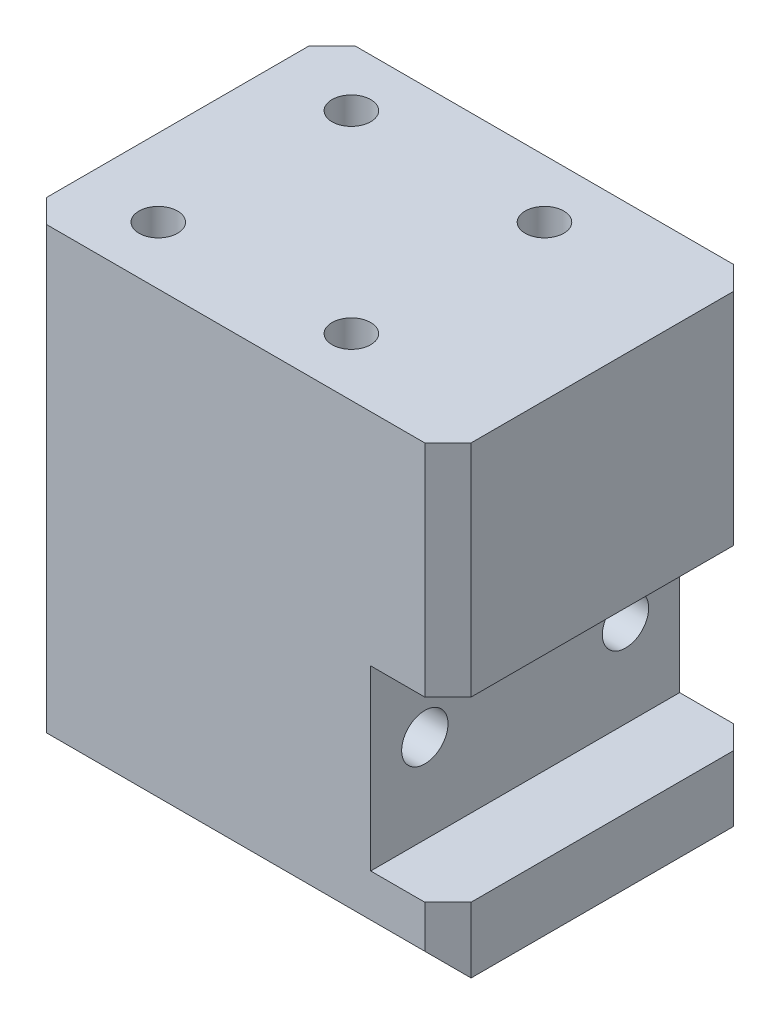
from build123d import *

# Parameters (mm, degrees)
SKETCH_1_W          = 22.5
SKETCH_1_H          = 20
EXTRUDE_1_DEPTH     = 20
SKETCH_2_W          = 20
SKETCH_2_H          = 4.25
EXTRUDE_2_DEPTH     = 5
SKETCH_3_R          = 1.5
CUT_EXTRUDE_1_DEPTH = 32.721443851
SKETCH_4_W          = 27.5
SKETCH_4_H          = 20
EXTRUDE_3_DEPTH     = 10
SKETCH_5_R          = 1.25
CUT_EXTRUDE_2_DEPTH = 15
CHAMFER_1_SIZE      = 1.5


with BuildPart() as part:
    # 草图1 → 凸台-拉伸1 (new body)
    with BuildSketch(Plane(origin=(0, 0, 0), x_dir=(1, 0, 0), z_dir=(0, 1, 0))):
        Rectangle(SKETCH_1_W, SKETCH_1_H)
    extrude(amount=EXTRUDE_1_DEPTH)

    # 草图2 → 凸台-拉伸2 (add)
    with BuildSketch(Plane(origin=(11.25, 0, 0), x_dir=(0, 0, -1), z_dir=(1, 0, 0))):
        with Locations((0, 17.875)):
            Rectangle(SKETCH_2_W, SKETCH_2_H)
        with Locations((0, 2.125)):
            Rectangle(SKETCH_2_W, SKETCH_2_H)
    extrude(amount=EXTRUDE_2_DEPTH)

    # 草图3 → 切除-拉伸1 (cut, through all)
    with BuildSketch(Plane(origin=(11.25, 0, 0), x_dir=(0, 0, -1), z_dir=(1, 0, 0))):
        with Locations((6.496047989, 10)):
            Circle(SKETCH_3_R)
        with Locations((-6.496047989, 10)):
            Circle(SKETCH_3_R)
    extrude(amount=-CUT_EXTRUDE_1_DEPTH, mode=Mode.SUBTRACT)

    # 草图4 → 凸台-拉伸3 (add)
    with BuildSketch(Plane(origin=(0, 20, 0), x_dir=(1, 0, 0), z_dir=(0, 1, 0))):
        with Locations((2.5, 0)):
            Rectangle(SKETCH_4_W, SKETCH_4_H)
    extrude(amount=EXTRUDE_3_DEPTH)

    # 草图5 → 切除-拉伸2 (cut)
    with BuildSketch(Plane(origin=(0, 30, 0), x_dir=(1, 0, 0), z_dir=(0, 1, 0))):
        with Locations(Location((6.25, 6.25, 0), (0, 0, 270))):
            Circle(SKETCH_5_R)
        with Locations(Location((6.25, -6.25, 0), (0, 0, 270))):
            Circle(SKETCH_5_R)
        with Locations(Location((-6.25, 6.25, 0), (0, 0, 270))):
            Circle(SKETCH_5_R)
        with Locations(Location((-6.25, -6.25, 0), (0, 0, 270))):
            Circle(SKETCH_5_R)
    extrude(amount=-CUT_EXTRUDE_2_DEPTH, mode=Mode.SUBTRACT)

    # 倒角1
    chamfer_1_edges = [part.edges().sort_by_distance(p)[0] for p in [
        (16.25, 22.875, 10),
        (16.25, 22.875, -10),
        (16.25, 2.125, -10),
        (16.25, 2.125, 10),
        (2.5, 0, -10),
        (2.5, 0, 10),
        (-11.25, 0, 0),
        (-11.25, 15, -10),
        (-11.25, 15, 10),
    ]]
    chamfer(chamfer_1_edges, length=CHAMFER_1_SIZE)


solid = part.part
